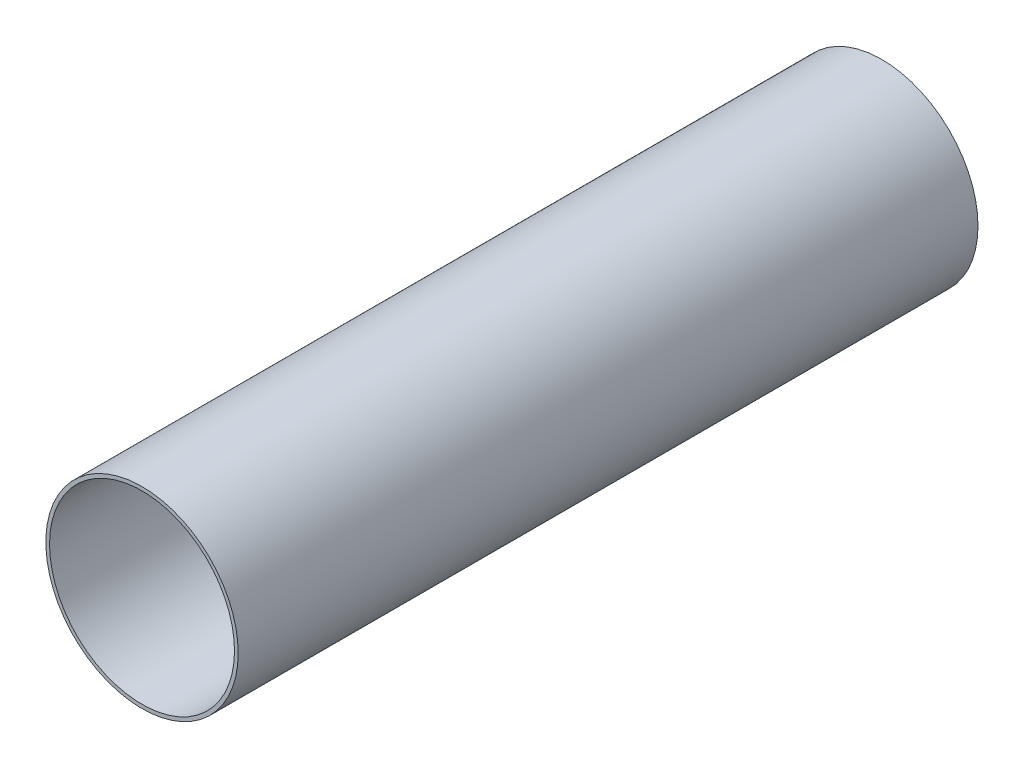
from build123d import *

# Parameters (mm, degrees)
ESQUISSE1_R        = 26
ESQUISSE1_R_2      = 25
BOSS_EXTRU_1_DEPTH = 200


with BuildPart() as part:
    # Esquisse1 → Boss.-Extru.1 (new body)
    with BuildSketch(Plane.XY):
        Circle(ESQUISSE1_R)
        Circle(ESQUISSE1_R_2, mode=Mode.SUBTRACT)
    extrude(amount=BOSS_EXTRU_1_DEPTH)


solid = part.part
